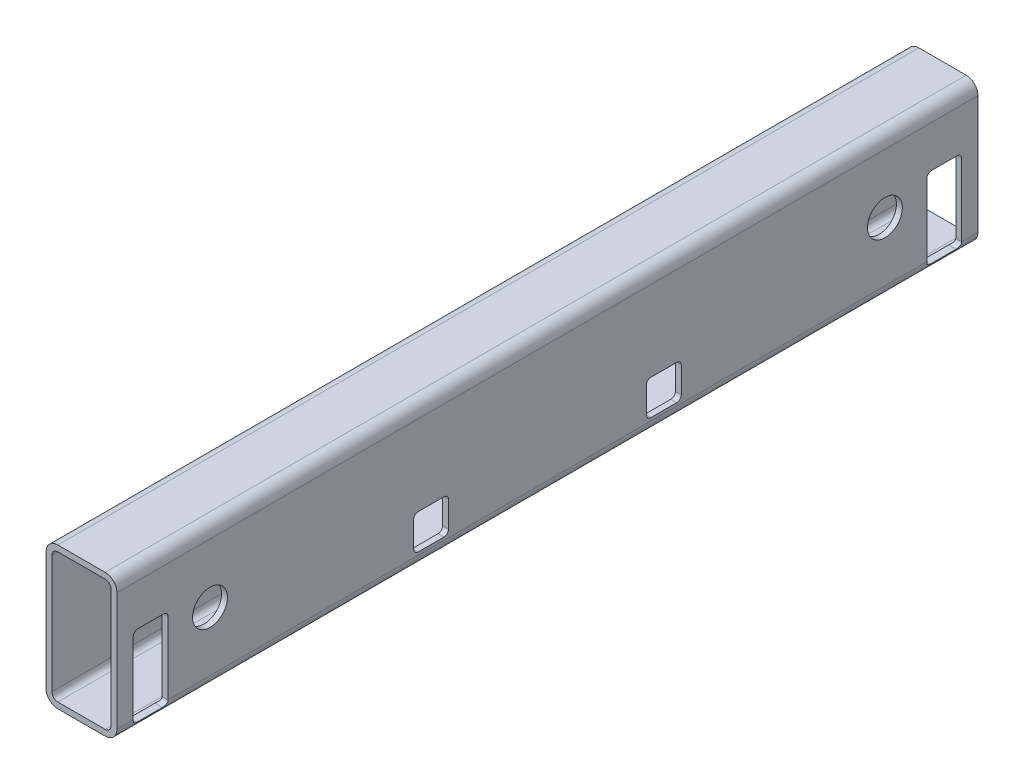
from build123d import *

# Parameters (mm, degrees)
BOSS_EXTRUDE1_DEPTH                       = 925
CUT_EXTRUDE1_DEPTH                        = 30
FOR_MACH_SHOP_CONFIRM_W_PROGRAMMING_REACH = 951.777
SKETCH5_R                                 = 37.5
CUT_EXTRUDE3_DEPTH                        = 950.777089767
CUT_EXTRUDE4_REACH                        = 951.777
SKETCH6_R                                 = 25


with BuildPart() as part:
    # Sketch1 → Boss-Extrude1 (new, symmetric)
    with BuildSketch(Plane.XY):
        with BuildLine():
            Line((-50.8, -152.4), (50.8, -152.4))
            ThreePointArc((50.8, -152.4), (68.760512242, -144.960512242), (76.2, -127))
            Line((76.2, -127), (76.2, 127))
            ThreePointArc((76.2, 127), (68.760512242, 144.960512242), (50.8, 152.4))
            Line((50.8, 152.4), (-50.8, 152.4))
            ThreePointArc((-50.8, 152.4), (-68.760512242, 144.960512242), (-76.2, 127))
            Line((-76.2, 127), (-76.2, -127))
            ThreePointArc((-76.2, -127), (-68.760512242, -144.960512242), (-50.8, -152.4))
        make_face()
        with BuildLine():
            Line((-50.8, -139.7), (50.8, -139.7))
            ThreePointArc((50.8, -139.7), (59.780256121, -135.980256121), (63.5, -127))
            Line((63.5, -127), (63.5, 127))
            ThreePointArc((63.5, 127), (59.780256121, 135.980256121), (50.8, 139.7))
            Line((50.8, 139.7), (-50.8, 139.7))
            ThreePointArc((-50.8, 139.7), (-59.780256121, 135.980256121), (-63.5, 127))
            Line((-63.5, 127), (-63.5, -127))
            ThreePointArc((-63.5, -127), (-59.780256121, -135.980256121), (-50.8, -139.7))
        make_face(mode=Mode.SUBTRACT)
    extrude(amount=BOSS_EXTRUDE1_DEPTH, both=True)

    # Sketch2 → Cut-Extrude1 (cut)
    with BuildSketch(Plane(origin=(76.2, 0, 0), x_dir=(0, 0, -1), z_dir=(1, 0, 0))):
        with BuildLine():
            Line((-880, 37.6), (-825, 37.6))
            ThreePointArc((-825, 37.6), (-817.928932188, 34.671067812), (-815, 27.6))
            Line((-815, 27.6), (-815, -127.4))
            ThreePointArc((-815, -127.4), (-817.928932188, -134.471067812), (-825, -137.4))
            Line((-825, -137.4), (-880, -137.4))
            ThreePointArc((-880, -137.4), (-887.071067812, -134.471067812), (-890, -127.4))
            Line((-890, -127.4), (-890, 27.6))
            ThreePointArc((-890, 27.6), (-887.071067812, 34.671067812), (-880, 37.6))
        make_face()
        with BuildLine():
            Line((825, 37.6), (880, 37.6))
            ThreePointArc((880, 37.6), (887.071067812, 34.671067812), (890, 27.6))
            Line((890, 27.6), (890, -127.4))
            ThreePointArc((890, -127.4), (887.071067812, -134.471067812), (880, -137.4))
            Line((880, -137.4), (825, -137.4))
            ThreePointArc((825, -137.4), (817.928932188, -134.471067812), (815, -127.4))
            Line((815, -127.4), (815, 27.6))
            ThreePointArc((815, 27.6), (817.928932188, 34.671067812), (825, 37.6))
        make_face()
    extrude(amount=-CUT_EXTRUDE1_DEPTH, mode=Mode.SUBTRACT)

    # Sketch3 → for mach shop confirm w/ programming (cut, up to next)
    with BuildSketch(Plane(origin=(76.2, 0, 0), x_dir=(0, 0, -1), z_dir=(1, 0, 0)), mode=Mode.PRIVATE) as for_mach_shop_confirm_w_programming_sk1:
        with BuildLine():
            Line((-277.5, -45.65), (-222.5, -45.65))
            ThreePointArc((-222.5, -45.65), (-215.428932188, -48.578932188), (-212.5, -55.65))
            Line((-212.5, -55.65), (-212.5, -110.65))
            ThreePointArc((-212.5, -110.65), (-215.428932188, -117.721067812), (-222.5, -120.65))
            Line((-222.5, -120.65), (-277.5, -120.65))
            ThreePointArc((-277.5, -120.65), (-284.571067812, -117.721067812), (-287.5, -110.65))
            Line((-287.5, -110.65), (-287.5, -55.65))
            ThreePointArc((-287.5, -55.65), (-284.571067812, -48.578932188), (-277.5, -45.65))
        make_face()
    for_mach_shop_confirm_w_programming_tool1 = extrude(for_mach_shop_confirm_w_programming_sk1.sketch, amount=-FOR_MACH_SHOP_CONFIRM_W_PROGRAMMING_REACH, mode=Mode.PRIVATE) & part.part
    # Sketch3 → for mach shop confirm w/ programming (cut, up to next)
    with BuildSketch(Plane(origin=(76.2, 0, 0), x_dir=(0, 0, -1), z_dir=(1, 0, 0)), mode=Mode.PRIVATE) as for_mach_shop_confirm_w_programming_sk2:
        with BuildLine():
            Line((222.5, -45.65), (277.5, -45.65))
            ThreePointArc((277.5, -45.65), (284.571067812, -48.578932188), (287.5, -55.65))
            Line((287.5, -55.65), (287.5, -110.65))
            ThreePointArc((287.5, -110.65), (284.571067812, -117.721067812), (277.5, -120.65))
            Line((277.5, -120.65), (222.5, -120.65))
            ThreePointArc((222.5, -120.65), (215.428932188, -117.721067812), (212.5, -110.65))
            Line((212.5, -110.65), (212.5, -55.65))
            ThreePointArc((212.5, -55.65), (215.428932188, -48.578932188), (222.5, -45.65))
        make_face()
    for_mach_shop_confirm_w_programming_tool2 = extrude(for_mach_shop_confirm_w_programming_sk2.sketch, amount=-FOR_MACH_SHOP_CONFIRM_W_PROGRAMMING_REACH, mode=Mode.PRIVATE) & part.part
    add(for_mach_shop_confirm_w_programming_tool1.solids().sort_by_distance((76.2, -83.15, 250))[0], mode=Mode.SUBTRACT)
    add(for_mach_shop_confirm_w_programming_tool2.solids().sort_by_distance((76.2, -83.15, -250))[0], mode=Mode.SUBTRACT)

    # Sketch5 → Cut-Extrude3 (cut, through all)
    with BuildSketch(Plane.ZY.offset(76.2)):
        with Locations((725, 0)):
            Circle(SKETCH5_R)
        with Locations((-725, 0)):
            Circle(SKETCH5_R)
    extrude(amount=-CUT_EXTRUDE3_DEPTH, mode=Mode.SUBTRACT)

    # Sketch6 → Cut-Extrude4 (cut, up to next)
    with BuildSketch(Plane.ZY.offset(76.2), mode=Mode.PRIVATE) as cut_extrude4_sk1:
        with Locations((-375, 0)):
            Circle(SKETCH6_R)
    cut_extrude4_tool1 = extrude(cut_extrude4_sk1.sketch, amount=-CUT_EXTRUDE4_REACH, mode=Mode.PRIVATE) & part.part
    # Sketch6 → Cut-Extrude4 (cut, up to next)
    with BuildSketch(Plane.ZY.offset(76.2), mode=Mode.PRIVATE) as cut_extrude4_sk2:
        with Locations((300, 0)):
            Circle(SKETCH6_R)
    cut_extrude4_tool2 = extrude(cut_extrude4_sk2.sketch, amount=-CUT_EXTRUDE4_REACH, mode=Mode.PRIVATE) & part.part
    # Sketch6 → Cut-Extrude4 (cut, up to next)
    with BuildSketch(Plane.ZY.offset(76.2), mode=Mode.PRIVATE) as cut_extrude4_sk3:
        with Locations((425, 0)):
            Circle(SKETCH6_R)
    cut_extrude4_tool3 = extrude(cut_extrude4_sk3.sketch, amount=-CUT_EXTRUDE4_REACH, mode=Mode.PRIVATE) & part.part
    add(cut_extrude4_tool1.solids().sort_by_distance((-76.2, 0, -375))[0], mode=Mode.SUBTRACT)
    add(cut_extrude4_tool2.solids().sort_by_distance((-76.2, 0, 300))[0], mode=Mode.SUBTRACT)
    add(cut_extrude4_tool3.solids().sort_by_distance((-76.2, 0, 425))[0], mode=Mode.SUBTRACT)


solid = part.part
